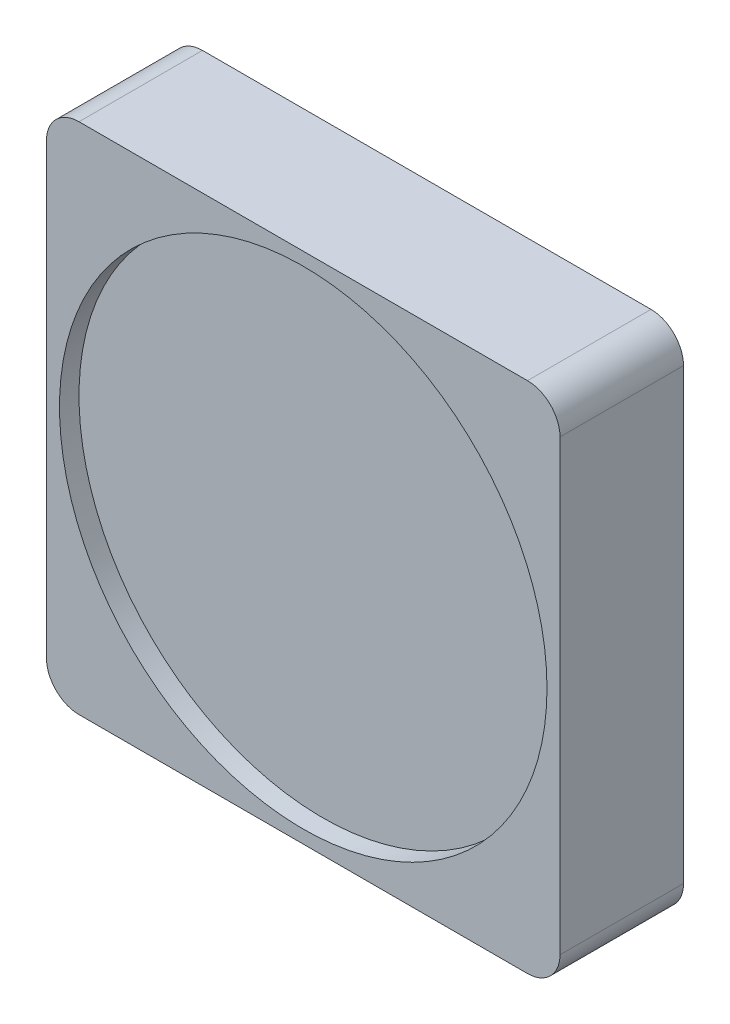
from build123d import *

# Parameters (mm, degrees)
SKETCH1_W           = 158
SKETCH1_H           = 158
BOSS_EXTRUDE1_DEPTH = 38
SKETCH2_R           = 75
CUT_EXTRUDE1_DEPTH  = 6
FILLET1_R           = 10


with BuildPart() as part:
    # Sketch1 → Boss-Extrude1 (new body)
    with BuildSketch(Plane.XY):
        with Locations((79, -79)):
            Rectangle(SKETCH1_W, SKETCH1_H)
    extrude(amount=BOSS_EXTRUDE1_DEPTH)

    # Sketch2 → Cut-Extrude1 (cut)
    with BuildSketch(Plane.XY.offset(38)):
        with Locations((79, -79)):
            Circle(SKETCH2_R)
    extrude(amount=-CUT_EXTRUDE1_DEPTH, mode=Mode.SUBTRACT)

    # Fillet1
    fillet1_edges = [part.edges().sort_by_distance(p)[0] for p in [
        (0, 0, 19),
        (158, 0, 19),
        (158, -158, 19),
        (0, -158, 19),
    ]]
    fillet(fillet1_edges, radius=FILLET1_R)


solid = part.part
